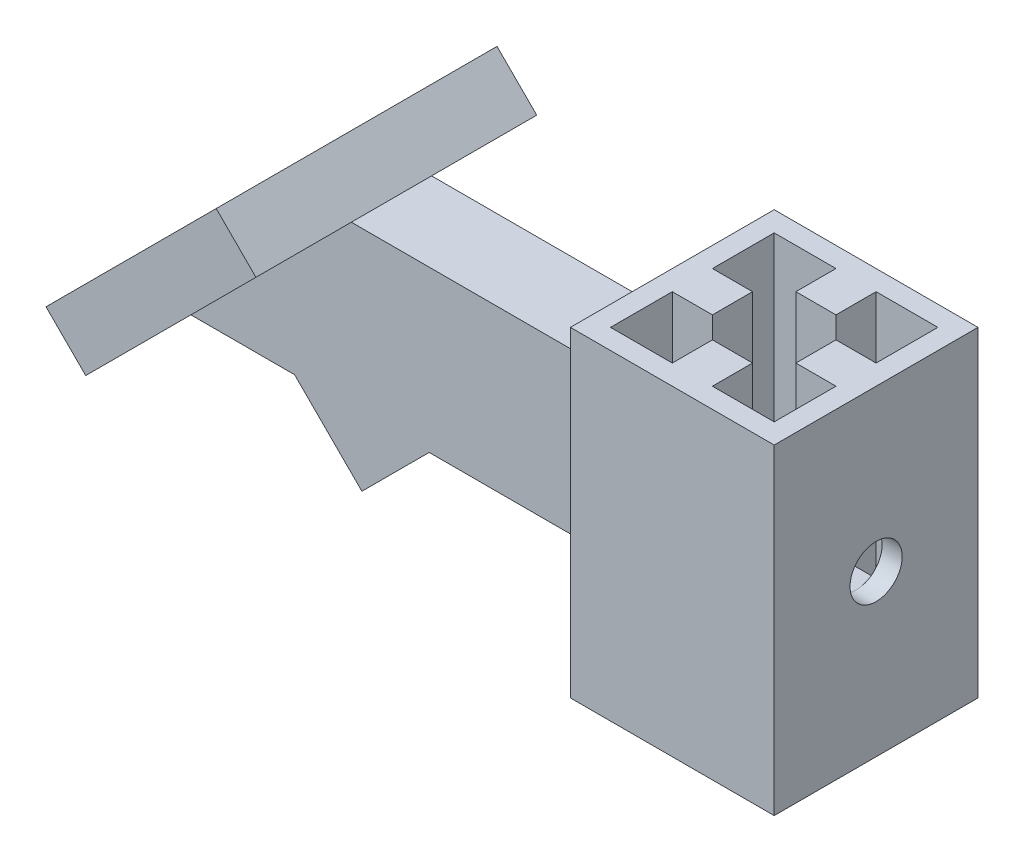
from build123d import *

# Parameters (mm, degrees)
CROQUIS1_W                 = 25.4
CROQUIS1_H                 = 25.4
SALIENTE_EXTRUIR1_DEPTH    = 40
SALIENTE_EXTRUIR3_DEPTH    = 17.5
SALIENTE_EXTRUIR4_REACH    = 76.655
CROQUIS6_W                 = 10
CROQUIS6_H                 = 20
CROQUIS9_R                 = 3.25
CORTAR_EXTRUIR3_DEPTH      = 10
CORTAR_EXTRUIR4_START      = -2.5
CROQUIS10_W                = 6.5
CROQUIS10_H                = 6.5
CORTAR_EXTRUIR4_DEPTH      = 10
CORTAR_EXTRUIR1_DEPTH      = 67.880303528
CORTAR_EXTRUIR1_DEPTH_BACK = 67.880303528
CROQUIS7_R                 = 3.5
SALIENTE_EXTRUIR5_START    = 21
CROQUIS11_W                = 10
CROQUIS11_H                = 10
CROQUIS11_R                = 3.5
SALIENTE_EXTRUIR5_DEPTH    = 21
SALIENTE_EXTRUIR6_START    = -10
SALIENTE_EXTRUIR6_DEPTH    = 10


with BuildPart() as part:
    # Croquis1 → Saliente-Extruir1 (new body)
    with BuildSketch(Plane(origin=(0, 0, 0), x_dir=(1, 0, 0), z_dir=(0, 1, 0))):
        Rectangle(CROQUIS1_W, CROQUIS1_H)
        Polygon((-10.2, 10.2), (-2.5, 10.2), (-2.5, 5.2), (2.5, 5.2), (2.5, 10.2), (10.2, 10.2), (10.2, 2.5), (5.2, 2.5), (5.2, -2.5), (10.2, -2.5), (10.2, -10.2), (2.5, -10.2), (2.5, -5.2), (-2.5, -5.2), (-2.5, -10.2), (-10.2, -10.2), (-10.2, -2.5), (-5.2, -2.5), (-5.2, 2.5), (-10.2, 2.5), align=None, mode=Mode.SUBTRACT)
    extrude(amount=SALIENTE_EXTRUIR1_DEPTH)



with BuildPart() as body_2:
    # Croquis4 → Saliente-Extruir3 (new, symmetric)
    with BuildSketch(Plane.XY):
        Polygon((-52.043145751, 35.556349186), (-47.093398282, 30.606601718), (-68.306601718, 9.393398282), (-73.256349186, 14.343145751), align=None)
    extrude(amount=SALIENTE_EXTRUIR3_DEPTH, both=True)


with BuildPart() as part_1:
    add(part.part)

    add(body_2.part)  # Saliente-Extruir4 merges body 2
    # Saliente-Extruir4: up to this plane
    saliente_extruir4_end = Plane(origin=(-68.306601718, 9.393398282, 17.5), z_dir=(-0.7071067811865436, 0.7071067811865516, 0))
    # Croquis6 → Saliente-Extruir4 (add, up to the surface)
    with BuildSketch(Plane.ZY.offset(12.7), mode=Mode.PRIVATE) as saliente_extruir4_sk1:
        with Locations((0, 20)):
            Rectangle(CROQUIS6_W, CROQUIS6_H)
    saliente_extruir4_tool1 = split(extrude(saliente_extruir4_sk1.sketch, amount=SALIENTE_EXTRUIR4_REACH, mode=Mode.PRIVATE), bisect_by=saliente_extruir4_end, keep=Keep.BOTH, mode=Mode.PRIVATE)
    add(saliente_extruir4_tool1.solids().sort_by_distance((-12.7, 20, 0))[0])

    # Croquis9 → Cortar-Extruir3 (cut)
    with BuildSketch(Plane(origin=(12.7, 0, 0), x_dir=(0, 0, -1), z_dir=(1, 0, 0))):
        with Locations((0, 20)):
            Circle(CROQUIS9_R)
    extrude(amount=-CORTAR_EXTRUIR3_DEPTH, mode=Mode.SUBTRACT)

    # Croquis10 → Cortar-Extruir4 (cut)
    with BuildSketch(Plane(origin=(12.7, 0, 0), x_dir=(0, 0, -1), z_dir=(1, 0, 0)).offset(CORTAR_EXTRUIR4_START)):
        with Locations((0, 20)):
            Rectangle(CROQUIS10_W, CROQUIS10_H)
    extrude(amount=-CORTAR_EXTRUIR4_DEPTH, mode=Mode.SUBTRACT)

    # Croquis7 → Cortar-Extruir1 (cut, two sides: drawn at the far end of the back side and taken through both)
    with BuildSketch(Plane(origin=(-38.85, 38.85, 0), x_dir=(0, 0, -1), z_dir=(0.7071067811865438, -0.7071067811865512, 0)).offset(-CORTAR_EXTRUIR1_DEPTH_BACK)):
        with Locations(Location((0, -26.657925651, 0), (0, 0, 90))):
            Circle(CROQUIS7_R)
    extrude(amount=CORTAR_EXTRUIR1_DEPTH + CORTAR_EXTRUIR1_DEPTH_BACK, mode=Mode.SUBTRACT)

    # Croquis11 → Saliente-Extruir5 (add)
    with BuildSketch(Plane(origin=(-38.85, 38.85, 0), x_dir=(0, 0, -1), z_dir=(0.7071067811865437, -0.7071067811865515, 0)).offset(SALIENTE_EXTRUIR5_START)):
        with Locations((0, -26.657925651)):
            Rectangle(CROQUIS11_W, CROQUIS11_H)
        with Locations(Location((0, -26.657925651, 0), (0, 0, 90))):
            Circle(CROQUIS11_R, mode=Mode.SUBTRACT)
    extrude(amount=-SALIENTE_EXTRUIR5_DEPTH)

    # Croquis12 → Saliente-Extruir6 (add)
    with BuildSketch(Plane.XY.offset(5).offset(SALIENTE_EXTRUIR6_START)):
        Polygon((-38.00151519, 10), (-40.628932188, 10), (-39.315223689, 8.686291501), align=None)
    extrude(amount=SALIENTE_EXTRUIR6_DEPTH)


solid = part_1.part
